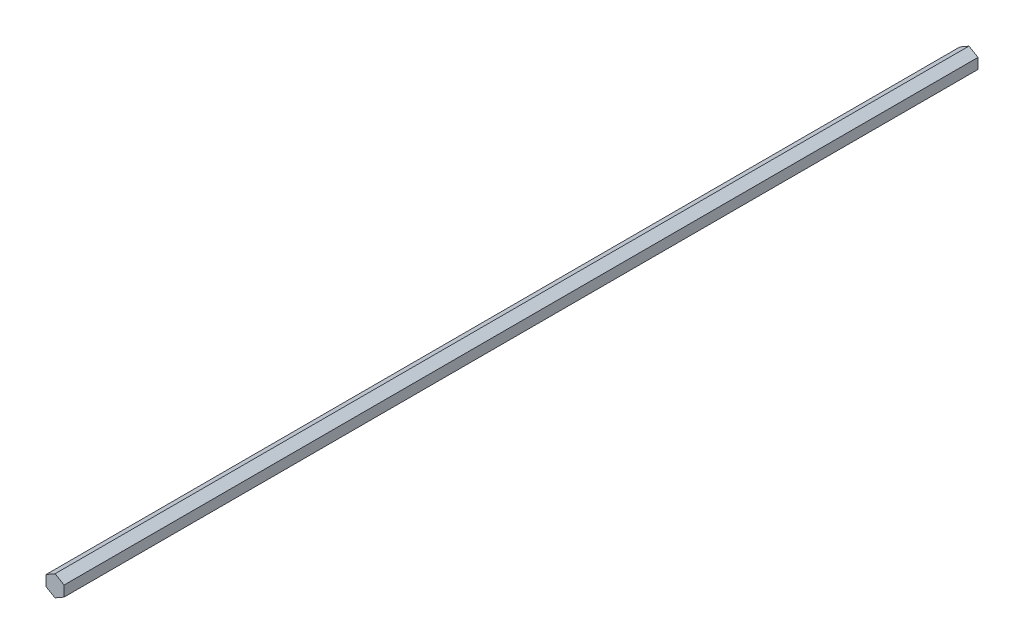
from build123d import *

# Parameters (mm, degrees)
BOSS_EXTRUDE1_DEPTH = 320.15938


with BuildPart() as part:
    # Sketch1 → Boss-Extrude1 (new, symmetric)
    with BuildSketch(Plane.XY):
        Polygon((0, 7.332348419), (-6.35, 3.666174209), (-6.35, -3.666174209), (0, -7.332348419), (6.35, -3.666174209), (6.35, 3.666174209), align=None)
    extrude(amount=BOSS_EXTRUDE1_DEPTH, both=True)


solid = part.part
